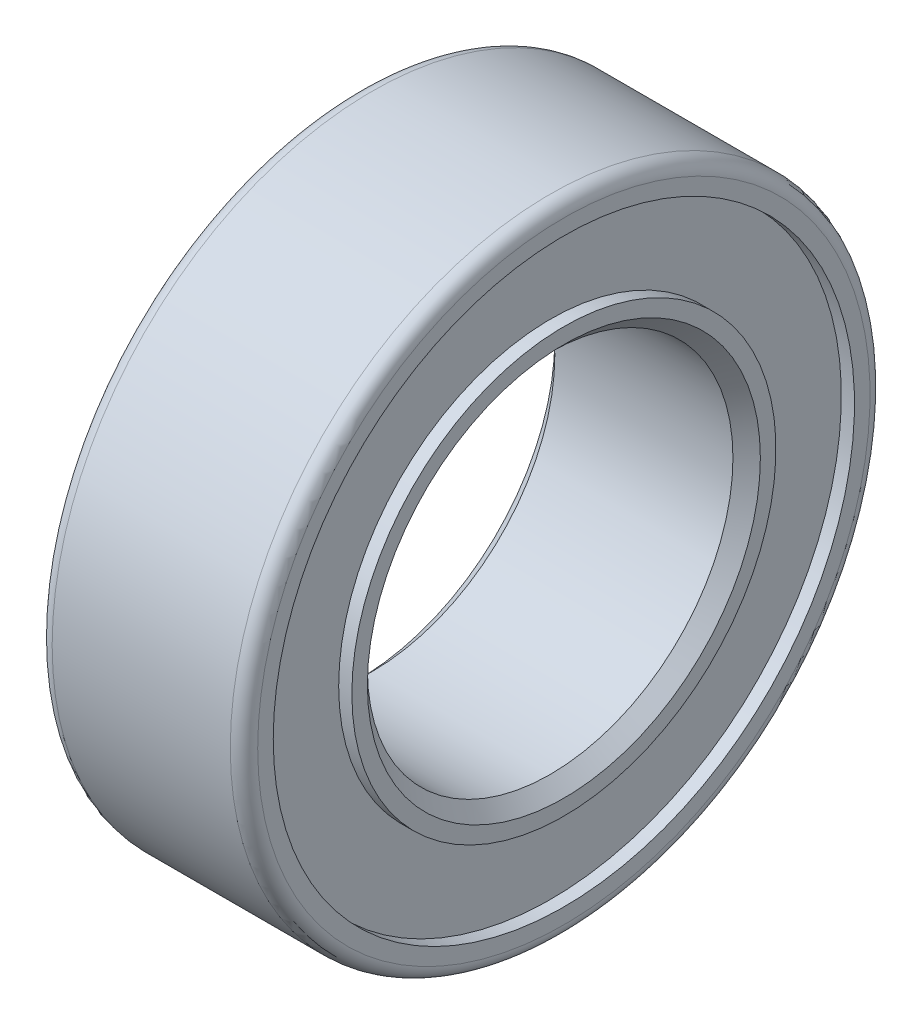
from build123d import *


with BuildPart() as part:
    # Sketch1 → Revolve1 (revolve)
    with BuildSketch(Plane(origin=(0, 0, 0), x_dir=(-1, 0, 0), z_dir=(0, 0, -1)), mode=Mode.PRIVATE) as revolve1_sk:
        with BuildLine():
            Line((-3.570224, 6.82625), (-3.093974, 6.35))
            Line((-3.093974, 6.35), (3.093974, 6.35))
            Line((3.093974, 6.35), (3.570224, 6.82625))
            Line((3.570224, 6.82625), (3.570224, 7.366))
            Line((3.570224, 7.366), (3.113024, 7.366))
            Line((3.113024, 7.366), (3.113024, 10.0965))
            Line((3.113024, 10.0965), (3.570224, 10.0965))
            Line((3.570224, 10.0965), (3.570224, 10.63625))
            ThreePointArc((3.570224, 10.63625), (3.430733604, 10.973009605), (3.093974, 11.1125))
            Line((3.093974, 11.1125), (-3.093974, 11.1125))
            ThreePointArc((-3.093974, 11.1125), (-3.430733605, 10.973009605), (-3.570224, 10.63625))
            Line((-3.570224, 10.63625), (-3.570224, 10.0965))
            Line((-3.570224, 10.0965), (-3.113024, 10.0965))
            Line((-3.113024, 10.0965), (-3.113024, 7.366))
            Line((-3.113024, 7.366), (-3.570224, 7.366))
            Line((-3.570224, 7.366), (-3.570224, 6.82625))
        make_face()
    revolve(revolve1_sk.sketch.rotate(Axis((3.571474002, 0, 0), (-1, 0, 0)), 270), axis=Axis((3.571474002, 0, 0), (-1, 0, 0)))


solid = part.part
